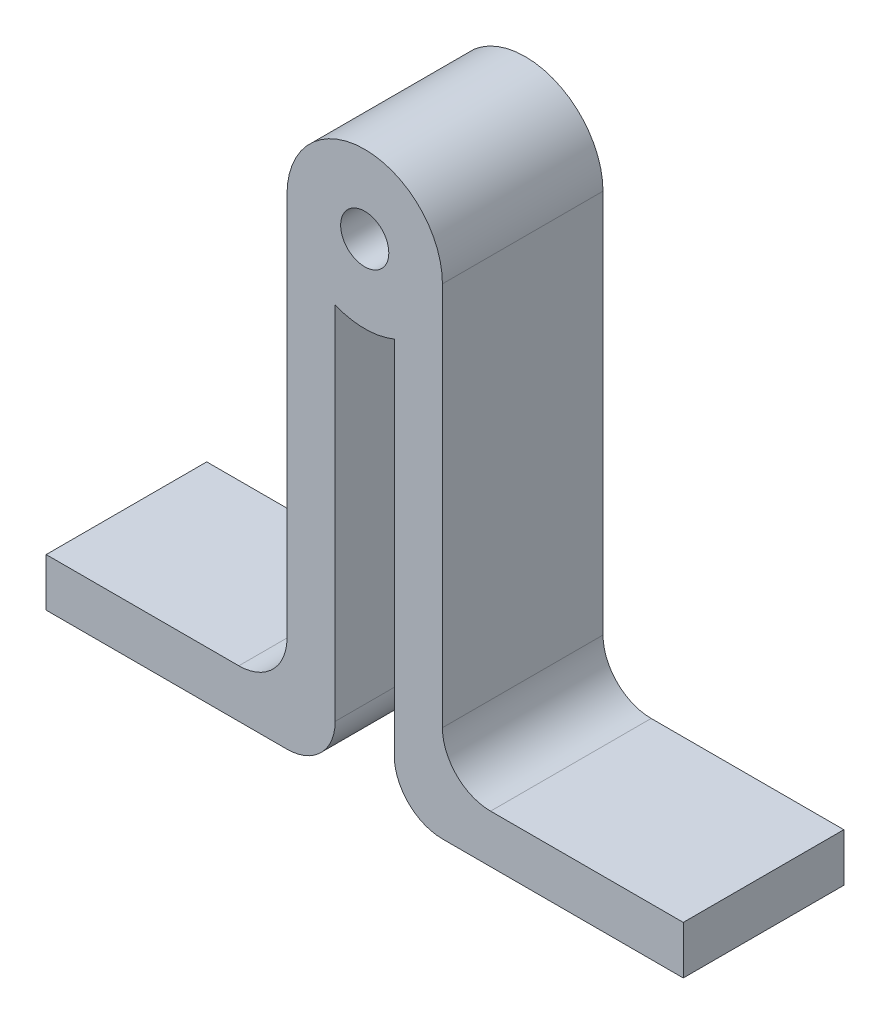
from build123d import *

# Parameters (mm, degrees)
SKETCH1_R           = 1.5
BOSS_EXTRUDE1_DEPTH = 10


with BuildPart() as part:
    # Sketch1 → Boss-Extrude1 (new body)
    with BuildSketch(Plane.XY):
        with BuildLine():
            Line((-1.84, -26.94), (-1.84, -4.476605857))
            ThreePointArc((-1.84, -4.476605857), (0, -4.84), (1.84, -4.476605857))
            Line((1.84, -4.476605857), (1.84, -26.94))
            ThreePointArc((1.84, -26.94), (2.718679656, -29.061320344), (4.84, -29.94))
            Line((4.84, -29.94), (19.84, -29.94))
            Line((19.84, -29.94), (19.84, -26.94))
            Line((19.84, -26.94), (7.84, -26.94))
            ThreePointArc((7.84, -26.94), (5.718679656, -26.061320344), (4.84, -23.94))
            Line((4.84, -23.94), (4.84, 0))
            ThreePointArc((4.84, 0), (0, 4.84), (-4.84, 0))
            Line((-4.84, 0), (-4.84, -23.94))
            ThreePointArc((-4.84, -23.94), (-5.718679656, -26.061320344), (-7.84, -26.94))
            Line((-7.84, -26.94), (-19.84, -26.94))
            Line((-19.84, -26.94), (-19.84, -29.94))
            Line((-19.84, -29.94), (-4.84, -29.94))
            ThreePointArc((-4.84, -29.94), (-2.718679656, -29.061320344), (-1.84, -26.94))
        make_face()
        Circle(SKETCH1_R, mode=Mode.SUBTRACT)
    extrude(amount=BOSS_EXTRUDE1_DEPTH)


solid = part.part
